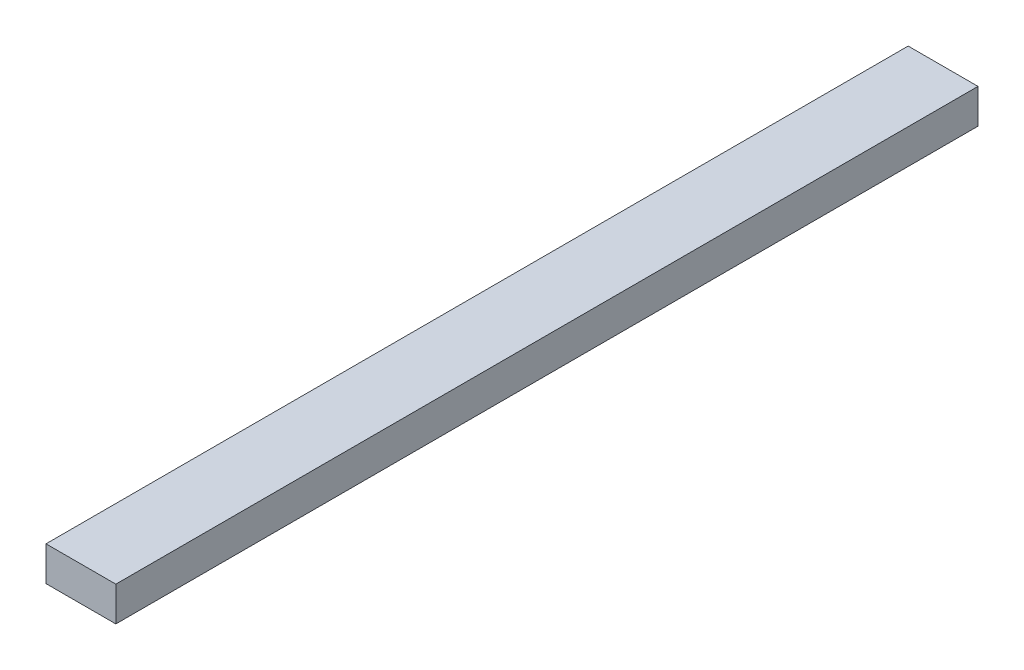
from build123d import *

# Parameters (mm, degrees)
SKETCH1_W           = 12.15
SKETCH1_H           = 6
BOSS_EXTRUDE1_DEPTH = 150


with BuildPart() as part:
    # Sketch1 → Boss-Extrude1 (new body)
    with BuildSketch(Plane.XY):
        Rectangle(SKETCH1_W, SKETCH1_H)
    extrude(amount=BOSS_EXTRUDE1_DEPTH)


solid = part.part
